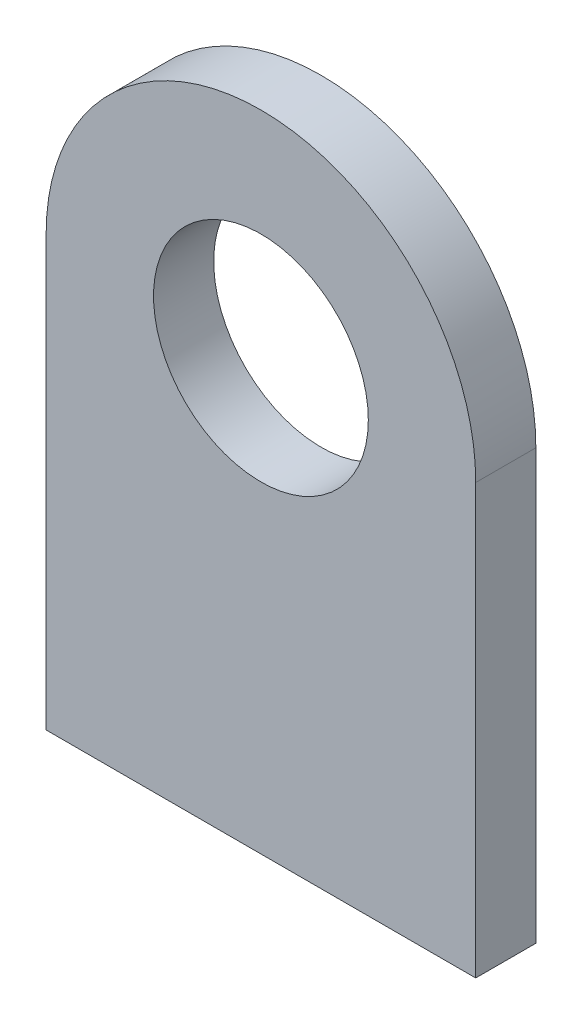
from build123d import *

# Parameters (mm, degrees)
ESBO_O1_R                = 12.5
RESSALTO_EXTRUS_O1_DEPTH = 7


with BuildPart() as part:
    # Esboço1 → Ressalto-extrusão1 (new body)
    with BuildSketch(Plane.XY):
        with BuildLine():
            Line((-25, -50), (25, -50))
            Line((25, -50), (25, -0.0537741))
            ThreePointArc((25, -0.0537741), (0.0537741, 25), (-25, 0.0537741))
            Line((-25, 0.0537741), (-25, -50))
        make_face()
        Circle(ESBO_O1_R, mode=Mode.SUBTRACT)
    extrude(amount=RESSALTO_EXTRUS_O1_DEPTH)


solid = part.part
